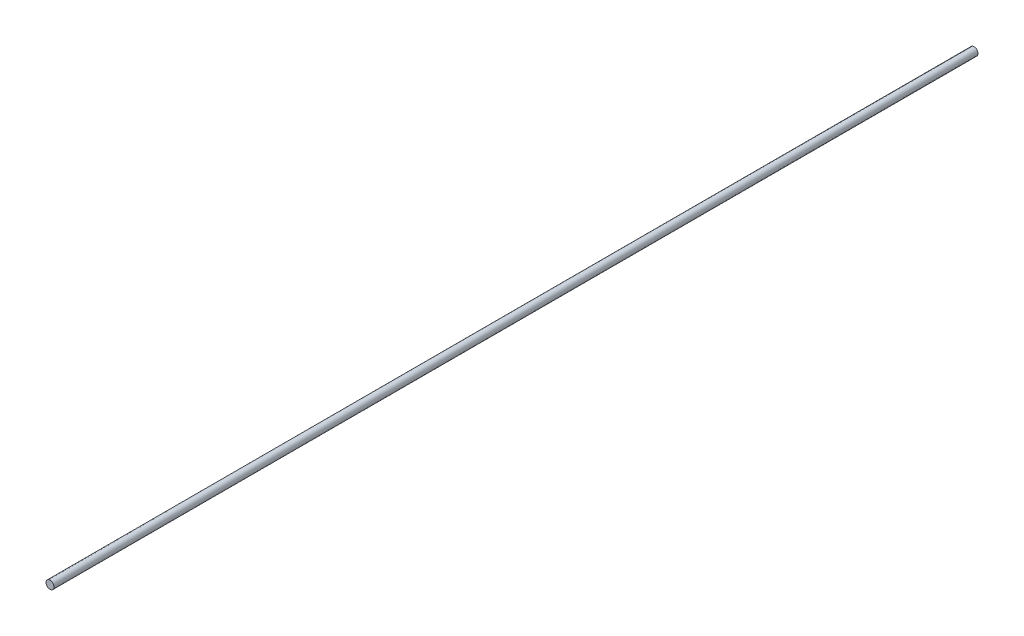
from build123d import *

# Parameters (mm, degrees)
SKETCH1_W = 1.5
SKETCH1_H = 350


with BuildPart() as part:
    # Sketch1 → Revolve1 (revolve)
    with BuildSketch(Plane.XZ, mode=Mode.PRIVATE) as revolve1_sk:
        with Locations((0.75, 175)):
            Rectangle(SKETCH1_W, SKETCH1_H)
    revolve(revolve1_sk.sketch.rotate(Axis((0, 0, 350), (0, 0, -1)), 180), axis=Axis((0, 0, 350), (0, 0, -1)))


solid = part.part
